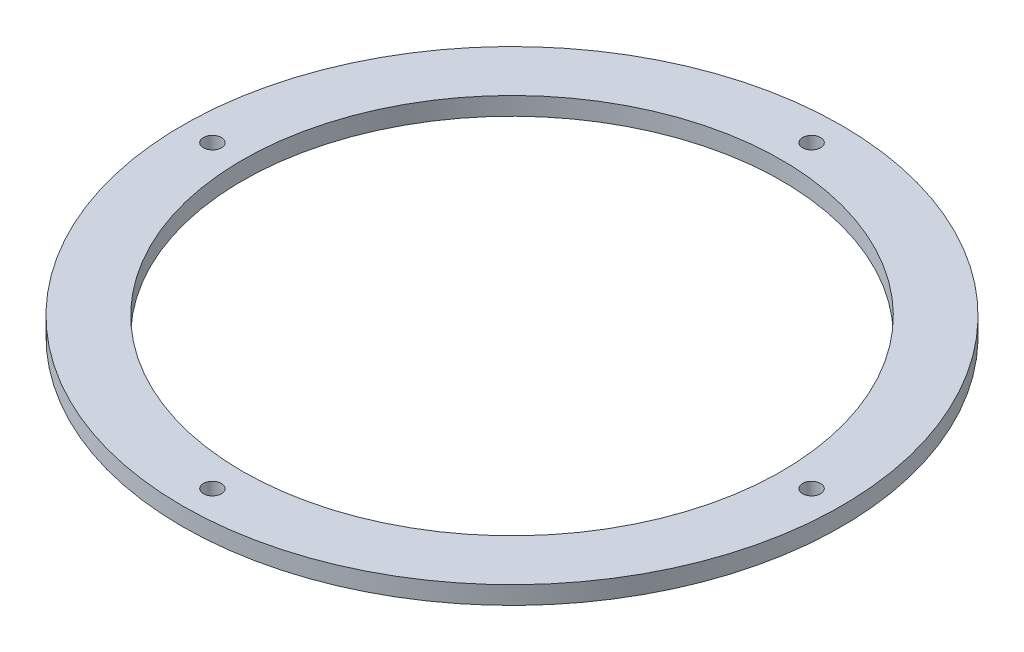
from build123d import *

# Parameters (mm, degrees)
SKETCH_1_R      = 55
SKETCH_1_R_2    = 1.5
SKETCH_1_R_3    = 45
EXTRUDE_1_DEPTH = 3


with BuildPart() as part:
    # 草图1 → 凸台-拉伸1 (new body)
    with BuildSketch(Plane(origin=(0, 0, 0), x_dir=(1, 0, 0), z_dir=(0, 1, 0))):
        with Locations(Location((0, 0, 0), (0, 0, 270))):
            Circle(SKETCH_1_R)
        with Locations(Location((-50, 0, 0), (0, 0, 270))):
            Circle(SKETCH_1_R_2, mode=Mode.SUBTRACT)
        with Locations(Location((0, -50, 0), (0, 0, 270))):
            Circle(SKETCH_1_R_2, mode=Mode.SUBTRACT)
        with Locations(Location((50, 0, 0), (0, 0, 270))):
            Circle(SKETCH_1_R_2, mode=Mode.SUBTRACT)
        with Locations(Location((0, 50, 0), (0, 0, 270))):
            Circle(SKETCH_1_R_2, mode=Mode.SUBTRACT)
        with Locations(Location((0, 0, 0), (0, 0, 270))):
            Circle(SKETCH_1_R_3, mode=Mode.SUBTRACT)
    extrude(amount=EXTRUDE_1_DEPTH)


solid = part.part
